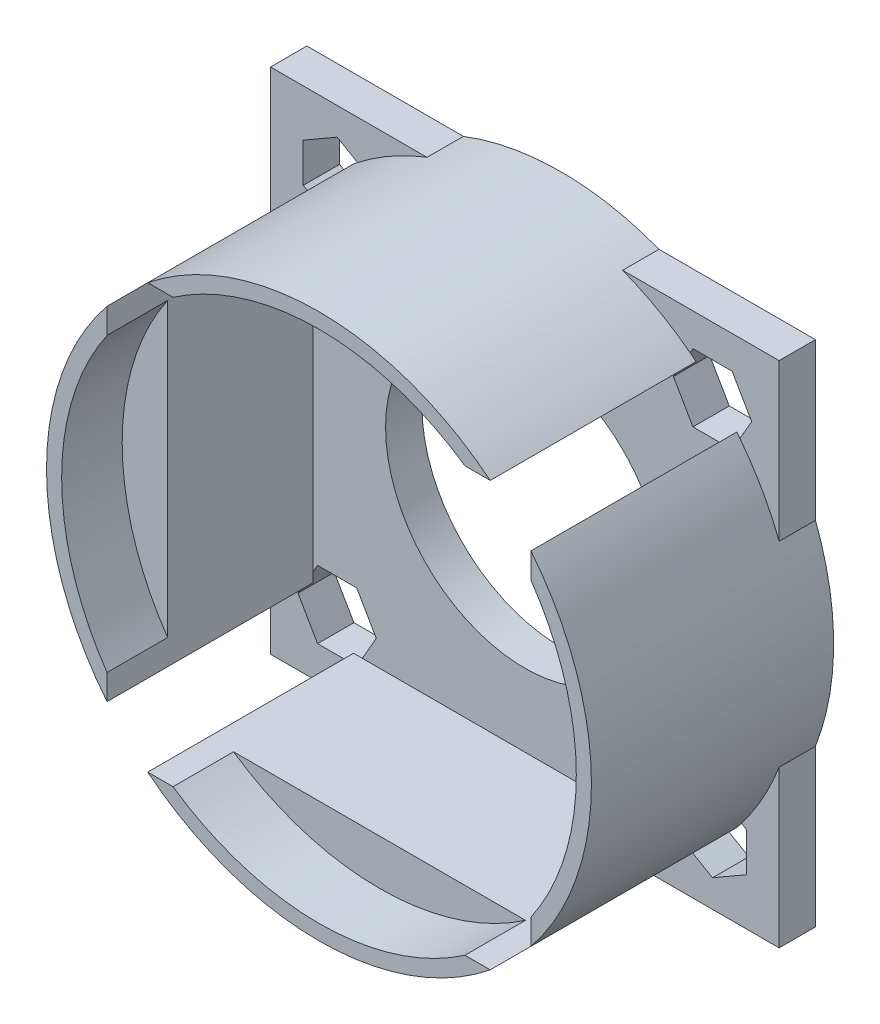
from build123d import *

# Parameters (mm, degrees)
SKETCH_1_W               = 42
SKETCH_1_H               = 42
SKETCH_1_R               = 1.5
SKETCH_1_R_2             = 11.5
EXTRUDE_1_DEPTH          = 3
EXTRUDE_2_DEPTH          = 20
SKETCH_5_R               = 21.25
CUT_EXTRUDE_3_DEPTH      = 5
CUT_EXTRUDE_4_DEPTH      = 3
PATTERN_CIRCULAR_1_COUNT = 4


with BuildPart() as part:
    # 草图1 → 凸台-拉伸1 (new body)
    with BuildSketch(Plane.XY):
        Rectangle(SKETCH_1_W, SKETCH_1_H)
        with Locations((15.5, 15.5)):
            Circle(SKETCH_1_R, mode=Mode.SUBTRACT)
        with Locations((15.5, -15.5)):
            Circle(SKETCH_1_R, mode=Mode.SUBTRACT)
        with Locations((-15.5, -15.5)):
            Circle(SKETCH_1_R, mode=Mode.SUBTRACT)
        with Locations((-15.5, 15.5)):
            Circle(SKETCH_1_R, mode=Mode.SUBTRACT)
        Circle(SKETCH_1_R_2, mode=Mode.SUBTRACT)
    extrude(amount=EXTRUDE_1_DEPTH)

    # 草图2 → 凸台-拉伸2 (add)
    with BuildSketch(Plane(origin=(0, 0, 0), x_dir=(-1, 0, 0), z_dir=(0, 0, -1))):
        with BuildLine():
            Line((17.5, 14.142135624), (17.5, -14.142135624))
            ThreePointArc((17.5, -14.142135624), (22.5, 0), (17.5, 14.142135624))
        make_face()
        with BuildLine():
            ThreePointArc((-14.142135624, -17.5), (0, -22.5), (14.142135624, -17.5))
            Line((14.142135624, -17.5), (-14.142135624, -17.5))
        make_face()
        with BuildLine():
            Line((-14.142135624, 17.5), (14.142135624, 17.5))
            ThreePointArc((14.142135624, 17.5), (0, 22.5), (-14.142135624, 17.5))
        make_face()
        with BuildLine():
            ThreePointArc((-17.5, 14.142135624), (-22.5, 0), (-17.5, -14.142135624))
            Line((-17.5, -14.142135624), (-17.5, 14.142135624))
        make_face()
    extrude(amount=-EXTRUDE_2_DEPTH)

    # 草图5 → 切除-拉伸3 (cut)
    with BuildSketch(Plane.XY.offset(20)):
        Circle(SKETCH_5_R)
    extrude(amount=-CUT_EXTRUDE_3_DEPTH, mode=Mode.SUBTRACT)

    # 草图6 → 切除-拉伸4 (cut)
    with BuildSketch(Plane(origin=(0, 0, 0), x_dir=(-1, 0, 0), z_dir=(0, 0, -1))):
        Polygon((18.3, 17.116580754), (15.5, 18.733161507), (12.7, 17.116580754), (12.7, 13.883419246), (15.5, 12.266838493), (18.3, 13.883419246), align=None)
    cut_extrude_4 = extrude(amount=-CUT_EXTRUDE_4_DEPTH, mode=Mode.SUBTRACT)

    # 阵列(圆周)1: 切除-拉伸4 ×4 about axis
    pattern_circular_1_axis = Axis((0, 0, 0), (0, 0, 1))
    for i in range(1, PATTERN_CIRCULAR_1_COUNT):
        add(cut_extrude_4.rotate(pattern_circular_1_axis, i * 360 / PATTERN_CIRCULAR_1_COUNT), mode=Mode.SUBTRACT)


solid = part.part
